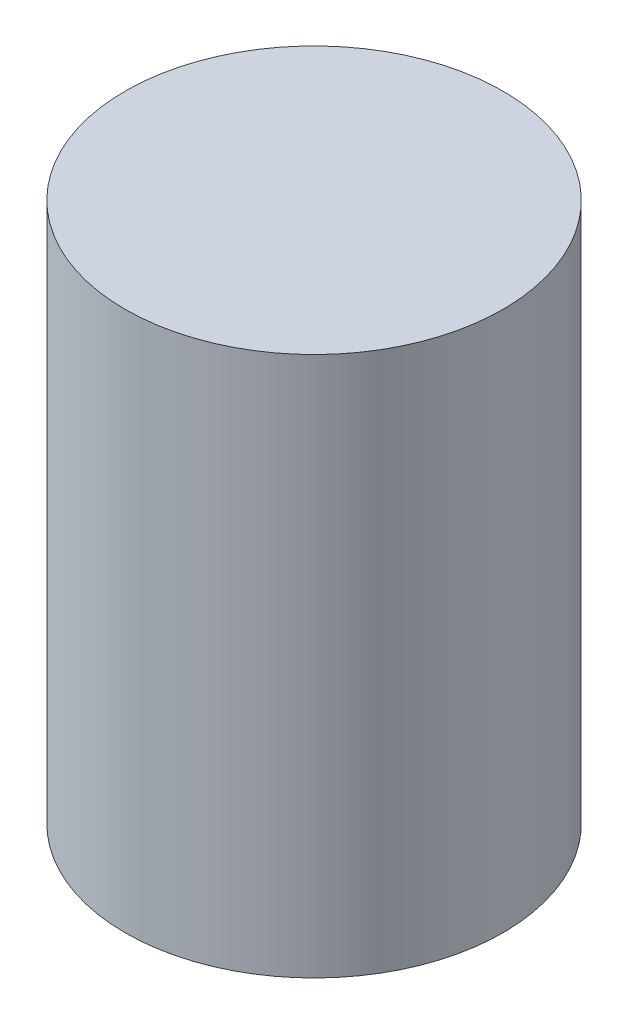
from build123d import *

# Parameters (mm, degrees)
SKETCH1_R           = 10.5
BOSS_EXTRUDE1_DEPTH = 30


with BuildPart() as part:
    # Sketch1 → Boss-Extrude1 (new body)
    with BuildSketch(Plane(origin=(0, 0, 0), x_dir=(1, 0, 0), z_dir=(0, 1, 0))):
        with Locations(Location((0, 0, 0), (0, 0, 270))):
            Circle(SKETCH1_R)
    extrude(amount=BOSS_EXTRUDE1_DEPTH)


solid = part.part
